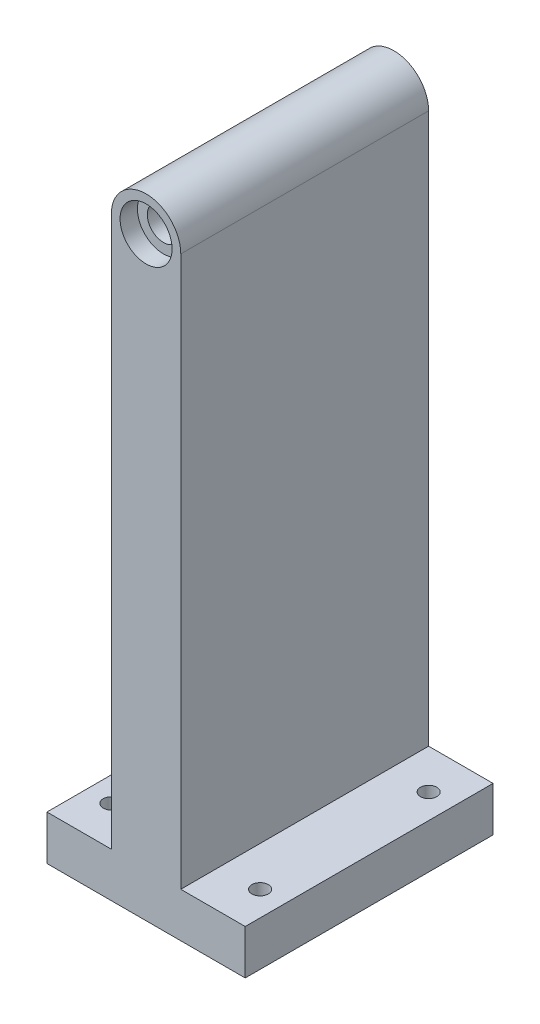
from build123d import *

# Parameters (mm, degrees)
SKETCH_2_W               = 240.549430728
SKETCH_2_H               = 149.540933388
EXTRUDE_1_DEPTH          = 5
SKETCH_6_W               = 93.246571425
SKETCH_6_H               = 149.540933388
EXTRUDE_4_DEPTH          = 5
SKETCH_8_W               = 274.716709757
SKETCH_8_H               = 58.51354913
EXTRUDE_6_DEPTH          = 5
CUT_EXTRUDE_2_DEPTH      = 252.755772101
CUT_EXTRUDE_2_DEPTH_BACK = 252.755772101
SKETCH_9_W               = 59.079292396
SKETCH_9_H               = 149.540933388
SKETCH_10_W              = 104.703380117
SKETCH_10_H              = 208.054482518
CUT_EXTRUDE_3_DEPTH      = 10
SKETCH_12_W              = 200
SKETCH_12_H              = 200
EXTRUDE_7_DEPTH          = 5
SKETCH_13_OUTSIDE_W      = 259.728
SKETCH_13_OUTSIDE_H      = 267.782
SKETCH_13_OUTSIDE_W_2    = 200
SKETCH_13_OUTSIDE_H_2    = 200
CUT_EXTRUDE_4_DEPTH      = 278.64321362
EXTRUDE_START            = -75
SKETCH_18_R              = 5.25
EXTRUDE_9_DEPTH          = 10
EXTRUDE_START_2          = -46
EXTRUDE_10_DEPTH         = 15
EXTRUDE_START_3          = -91.2
EXTRUDE_11_DEPTH         = 15
EXTRUDE_12_REACH         = 307.894
SKETCH_20_R              = 5.25
SKETCH_26_W              = 200
SKETCH_26_H              = 5
EXTRUDE_13_DEPTH         = 100
SKETCH_27_W              = 200
SKETCH_27_H              = 5
CUT_EXTRUDE_5_DEPTH      = 30
EXTRUDE_14_DEPTH         = 10
SKETCH_29_W              = 60
SKETCH_29_H              = 9
EXTRUDE_15_DEPTH         = 10
HOLE_WIZARD_M4_1_D       = 3.3
HOLE_WIZARD_M4_2_D       = 3.3
HOLE_WIZARD_M4_3_D       = 3.3
EXTRUDE_16_DEPTH         = 10
SKETCH_37_W              = 60
SKETCH_37_H              = 9
EXTRUDE_17_DEPTH         = 10
HOLE_WIZARD_M4_4_D       = 3.3
EXTRUDE_START_4          = -3.5
SKETCH_40_R              = 5.25
SKETCH_40_R_2            = 3.25
EXTRUDE_18_DEPTH         = 46.5
CUT_EXTRUDE_START        = -3.5
SKETCH_41_R              = 5.25
SKETCH_41_R_2            = 3.25
CUT_EXTRUDE_6_DEPTH      = 3.5
HOLE_WIZARD_M4_5_D       = 3.3
SKETCH_44_W              = 270
SKETCH_44_H              = 5
CUT_EXTRUDE_7_DEPTH      = 400.170489639
CUT_EXTRUDE_8_DEPTH      = 274.053696703
CUT_EXTRUDE_8_DEPTH_BACK = 274.053696703
SKETCH_45_W              = 100.422934587
SKETCH_45_H              = 170.865744653


with BuildPart() as part:
    # 草图2 → 凸台-拉伸1 (new body)
    with BuildSketch(Plane(origin=(0, 0, 0), x_dir=(1, 0, 0), z_dir=(0, 1, 0))):
        Rectangle(SKETCH_2_W, SKETCH_2_H)
    extrude(amount=EXTRUDE_1_DEPTH)

    # 草图6 → 凸台-拉伸4 (add)
    with BuildSketch(Plane(origin=(0, 5, 0), x_dir=(1, 0, 0), z_dir=(0, 1, 0))):
        with Locations((166.898001077, 0)):
            Rectangle(SKETCH_6_W, SKETCH_6_H)
    extrude(amount=-EXTRUDE_4_DEPTH)

    # 草图8 → 凸台-拉伸6 (add)
    with BuildSketch(Plane(origin=(0, 5, 0), x_dir=(1, 0, 0), z_dir=(0, 1, 0))):
        with Locations((76.162931911, -104.027241259)):
            Rectangle(SKETCH_8_W, SKETCH_8_H)
    extrude(amount=-EXTRUDE_6_DEPTH)

    # 草图9 → 切除-拉伸2 (cut, two sides: drawn at the far end of the back side and taken through both)
    with BuildSketch(Plane(origin=(0, 5, 0), x_dir=(1, 0, 0), z_dir=(0, 1, 0)).offset(-CUT_EXTRUDE_2_DEPTH_BACK)):
        with Locations((-90.735069166, 0)):
            Rectangle(SKETCH_9_W, SKETCH_9_H)
    extrude(amount=CUT_EXTRUDE_2_DEPTH + CUT_EXTRUDE_2_DEPTH_BACK, mode=Mode.SUBTRACT)

    # 草图10 → 切除-拉伸3 (cut)
    with BuildSketch(Plane(origin=(0, 5, 0), x_dir=(1, 0, 0), z_dir=(0, 1, 0))):
        with Locations((-8.84373291, -29.256774565)):
            Rectangle(SKETCH_10_W, SKETCH_10_H)
    extrude(amount=-CUT_EXTRUDE_3_DEPTH, mode=Mode.SUBTRACT)

    # 草图12 → 凸台-拉伸7 (add)
    with BuildSketch(Plane(origin=(0, 5, 0), x_dir=(1, 0, 0), z_dir=(0, 1, 0))):
        with Locations((143.507957149, -25.229533306)):
            Rectangle(SKETCH_12_W, SKETCH_12_H)
    extrude(amount=-EXTRUDE_7_DEPTH)

    # 草图13 outside → 切除-拉伸4 (cut, through all)
    with BuildSketch(Plane(origin=(0, 5, 0), x_dir=(1, 0, 0), z_dir=(0, 1, 0))):
        with Locations((143.508, -29.257)):
            Rectangle(SKETCH_13_OUTSIDE_W, SKETCH_13_OUTSIDE_H)
        with Locations((143.507957149, -25.229533306)):
            Rectangle(SKETCH_13_OUTSIDE_W_2, SKETCH_13_OUTSIDE_H_2, mode=Mode.SUBTRACT)
    extrude(amount=-CUT_EXTRUDE_4_DEPTH, mode=Mode.SUBTRACT)

    # 草图18 → 凸台-拉伸9 (add)
    with BuildSketch(Plane.XY.offset(125.229533306).offset(EXTRUDE_START)):
        with BuildLine():
            Line((95.507957149, 14), (95.507957149, 125))
            ThreePointArc((95.507957149, 125), (88.507957149, 132), (81.507957149, 125))
            Line((81.507957149, 125), (81.507957149, 14))
            Line((81.507957149, 14), (68.507957149, 14))
            Line((68.507957149, 14), (68.507957149, 5))
            Line((68.507957149, 5), (108.507957149, 5))
            Line((108.507957149, 5), (108.507957149, 14))
            Line((108.507957149, 14), (95.507957149, 14))
        make_face()
        with Locations((88.507957149, 125)):
            Circle(SKETCH_18_R, mode=Mode.SUBTRACT)
    extrude_9 = extrude(amount=-EXTRUDE_9_DEPTH)

    # 镜向1: 凸台-拉伸9 across plane
    add(extrude_9.mirror(Plane.XY.offset(25.229533306)))

    # 草图16 → 凸台-拉伸10 (add)
    with BuildSketch(Plane(origin=(243.507957149, 0, 0), x_dir=(0, 0, -1), z_dir=(1, 0, 0)).offset(EXTRUDE_START_2)):
        with BuildLine():
            Line((-53.779533306, 14), (-53.779533306, 145.085631965))
            Line((-53.779533306, 145.085631965), (-67.779533306, 145.085631965))
            Line((-67.779533306, 145.085631965), (-67.779533306, 139.085631965))
            ThreePointArc((-67.779533306, 139.085631965), (-69.779533306, 114.75), (-71.779533306, 139.085631965))
            Line((-71.779533306, 139.085631965), (-71.779533306, 145.085631965))
            Line((-71.779533306, 145.085631965), (-85.779533306, 145.085631965))
            Line((-85.779533306, 145.085631965), (-85.779533306, 14))
            Line((-85.779533306, 14), (-99.779533306, 14))
            Line((-99.779533306, 14), (-99.779533306, 5))
            Line((-99.779533306, 5), (-39.779533306, 5))
            Line((-39.779533306, 5), (-39.779533306, 14))
            Line((-39.779533306, 14), (-53.779533306, 14))
        make_face()
    extrude(amount=-EXTRUDE_10_DEPTH)

    # 草图19 → 凸台-拉伸11 (add)
    with BuildSketch(Plane(origin=(243.507957149, 0, 0), x_dir=(0, 0, -1), z_dir=(1, 0, 0)).offset(EXTRUDE_START_3)):
        with BuildLine():
            Line((37.990466694, 14), (37.990466694, 144.933566106))
            Line((37.990466694, 144.933566106), (23.990466694, 144.933566106))
            Line((23.990466694, 144.933566106), (23.990466694, 138.933566106))
            ThreePointArc((23.990466694, 138.933566106), (21.990466694, 114.9), (19.990466694, 138.933566106))
            Line((19.990466694, 138.933566106), (19.990466694, 144.933566106))
            Line((19.990466694, 144.933566106), (5.990466694, 144.933566106))
            Line((5.990466694, 144.933566106), (5.990466694, 14))
            Line((5.990466694, 14), (-8.009533306, 14))
            Line((-8.009533306, 14), (-8.009533306, 5))
            Line((-8.009533306, 5), (51.990466694, 5))
            Line((51.990466694, 5), (51.990466694, 14))
            Line((51.990466694, 14), (37.990466694, 14))
        make_face()
    extrude(amount=-EXTRUDE_11_DEPTH)

    # 草图20 → 凸台-拉伸12 (add, up to next)
    with BuildSketch(Plane(origin=(0, 0, 40.229533306), x_dir=(-1, 0, 0), z_dir=(0, 0, -1)), mode=Mode.PRIVATE) as extrude_12_sk1:
        with BuildLine():
            Line((-108.507957149, 5), (-68.507957149, 5))
            Line((-68.507957149, 5), (-68.507957149, 14))
            Line((-68.507957149, 14), (-81.507957149, 14))
            Line((-81.507957149, 14), (-81.507957149, 125))
            ThreePointArc((-81.507957149, 125), (-88.507957149, 132), (-95.507957149, 125))
            Line((-95.507957149, 125), (-95.507957149, 14))
            Line((-95.507957149, 14), (-108.507957149, 14))
            Line((-108.507957149, 14), (-108.507957149, 5))
        make_face()
        with Locations(Location((-88.507957149, 125, 0), (0, 0, 180))):
            Circle(SKETCH_20_R, mode=Mode.SUBTRACT)
    extrude_12_tool1 = extrude(extrude_12_sk1.sketch, amount=EXTRUDE_12_REACH, mode=Mode.PRIVATE) - part.part
    add(extrude_12_tool1.solids().sort_by_distance((88.507957, 57.997401, 40.229533))[0])

    # 草图26 → 凸台-拉伸13 (add)
    with BuildSketch(Plane(origin=(243.507957149, 0, 0), x_dir=(0, 0, -1), z_dir=(1, 0, 0))):
        with Locations((-25.229533306, 2.5)):
            Rectangle(SKETCH_26_W, SKETCH_26_H)
    extrude(amount=EXTRUDE_13_DEPTH)

    # 草图27 → 切除-拉伸5 (cut)
    with BuildSketch(Plane(origin=(343.507957149, 0, 0), x_dir=(0, 0, -1), z_dir=(1, 0, 0))):
        with Locations((-25.229533306, 2.5)):
            Rectangle(SKETCH_27_W, SKETCH_27_H)
    extrude(amount=-CUT_EXTRUDE_5_DEPTH, mode=Mode.SUBTRACT)

    # 草图28 → 凸台-拉伸14 (add)
    with BuildSketch(Plane(origin=(197.507957149, 0, 0), x_dir=(0, 0, -1), z_dir=(1, 0, 0))):
        Polygon((-85.779533306, 14), (-53.779533306, 14), (-39.779533306, 14), (-39.779533306, 5), (-99.779533306, 5), (-99.779533306, 14), align=None)
    extrude(amount=EXTRUDE_14_DEPTH)

    # 草图29 → 凸台-拉伸15 (add)
    with BuildSketch(Plane.ZY.offset(-182.507957149)):
        with Locations((69.779533306, 9.5)):
            Rectangle(SKETCH_29_W, SKETCH_29_H)
    extrude(amount=EXTRUDE_15_DEPTH)

    # M4 螺纹孔1 (through all)
    with Locations(Plane(origin=(0, 14, 0), x_dir=(1, 0, 0), z_dir=(0, 1, 0))):
        with Locations((178.507957149, -47.779533306), (201.507957149, -47.779533306), (201.507957149, -91.779533306), (178.507957149, -91.779533306)):
            Hole(HOLE_WIZARD_M4_1_D / 2)

    # M4 螺纹孔2 (through all)
    with Locations(Plane.XY.offset(85.779533306)):
        with Locations((190.007957149, 141.085631965)):
            Hole(HOLE_WIZARD_M4_2_D / 2)

    # M4 螺纹孔3 (through all)
    with Locations(Plane.XY.offset(-5.990466694)):
        with Locations((144.807957149, 140.933566106)):
            Hole(HOLE_WIZARD_M4_3_D / 2)

    # 草图36 → 凸台-拉伸16 (add)
    with BuildSketch(Plane(origin=(152.307957149, 0, 0), x_dir=(0, 0, -1), z_dir=(1, 0, 0))):
        Polygon((5.990466694, 14), (37.990466694, 14), (51.990466694, 14), (51.990466694, 5), (-8.009533306, 5), (-8.009533306, 14), align=None)
    extrude(amount=EXTRUDE_16_DEPTH)

    # 草图37 → 凸台-拉伸17 (add)
    with BuildSketch(Plane.ZY.offset(-137.307957149)):
        with Locations((-21.990466694, 9.5)):
            Rectangle(SKETCH_37_W, SKETCH_37_H)
    extrude(amount=EXTRUDE_17_DEPTH)

    # M4 螺纹孔4 (through all)
    with Locations(Plane(origin=(0, 14, 0), x_dir=(1, 0, 0), z_dir=(0, 1, 0))):
        with Locations((133.307957149, 43.990466694), (156.307957149, 43.990466694), (156.307957149, -0.009533306), (133.307957149, -0.009533306)):
            Hole(HOLE_WIZARD_M4_4_D / 2)

    # 草图40 → 凸台-拉伸18 (add)
    with BuildSketch(Plane.XY.offset(50.229533306).offset(EXTRUDE_START_4)):
        with Locations((88.507957149, 125)):
            Circle(SKETCH_40_R)
        with Locations((88.507957149, 125)):
            Circle(SKETCH_40_R_2, mode=Mode.SUBTRACT)
    extrude(amount=-EXTRUDE_18_DEPTH)

    # 草图41 → 切除-拉伸6 (cut)
    with BuildSketch(Plane(origin=(0, 0, 0.229533306), x_dir=(-1, 0, 0), z_dir=(0, 0, -1)).offset(CUT_EXTRUDE_START)):
        with Locations(Location((-88.507957149, 125, 0), (0, 0, 180))):
            Circle(SKETCH_41_R)
        with Locations(Location((-88.507957149, 125, 0), (0, 0, 180))):
            Circle(SKETCH_41_R_2, mode=Mode.SUBTRACT)
    extrude(amount=CUT_EXTRUDE_6_DEPTH, mode=Mode.SUBTRACT)

    # M4 螺纹孔5 (through all)
    with Locations(Plane(origin=(0, 14, 0), x_dir=(1, 0, 0), z_dir=(0, 1, 0))):
        with Locations((73.507957149, -8.229533306), (103.507957149, -8.229533306), (103.507957149, -42.229533306), (73.507957149, -42.229533306)):
            Hole(HOLE_WIZARD_M4_5_D / 2)

    # 草图44 → 切除-拉伸7 (cut, through all)
    with BuildSketch(Plane.XY.offset(125.229533306)):
        with Locations((178.507957149, 2.5)):
            Rectangle(SKETCH_44_W, SKETCH_44_H)
    extrude(amount=-CUT_EXTRUDE_7_DEPTH, mode=Mode.SUBTRACT)


with BuildPart() as cut_extrude_7_piece_1:
    # of the separate pieces the step leaves, piece 1, a body of its own (cut_extrude_7_pieces)
    add(part.part.solids().sort_by_distance((68.507957149, 14, 50.229533306))[0])


with BuildPart() as cut_extrude_7_piece_2:
    # of the separate pieces the step leaves, piece 2, a body of its own (cut_extrude_7_pieces)
    add(part.part.solids().sort_by_distance((127.307957149, 14, 8.009533306))[0])


with BuildPart() as cut_extrude_7_piece_3:
    # of the separate pieces the step leaves, piece 3, a body of its own (cut_extrude_7_pieces)
    add(part.part.solids().sort_by_distance((172.507957149, 14, 99.779533306))[0])


with BuildPart() as cut_extrude_8_tool:
    # 草图45 → 切除-拉伸8 (new, two sides: drawn at the far end of the back side and taken through both)
    with BuildSketch(Plane.XY.offset(50.229533306).offset(-CUT_EXTRUDE_8_DEPTH_BACK)):
        with Locations((168.17278759, 76.071196607)):
            Rectangle(SKETCH_45_W, SKETCH_45_H)
    extrude(amount=CUT_EXTRUDE_8_DEPTH + CUT_EXTRUDE_8_DEPTH_BACK)


with BuildPart() as cut_extrude_7_piece_2_1:
    add(cut_extrude_7_piece_2.part)

    # 切除-拉伸8: cut by cut_extrude_8_tool
    add(cut_extrude_8_tool.part, mode=Mode.SUBTRACT)


with BuildPart() as cut_extrude_7_piece_3_1:
    add(cut_extrude_7_piece_3.part)

    # 切除-拉伸8: cut by cut_extrude_8_tool
    add(cut_extrude_8_tool.part, mode=Mode.SUBTRACT)


solid = cut_extrude_7_piece_1.part
